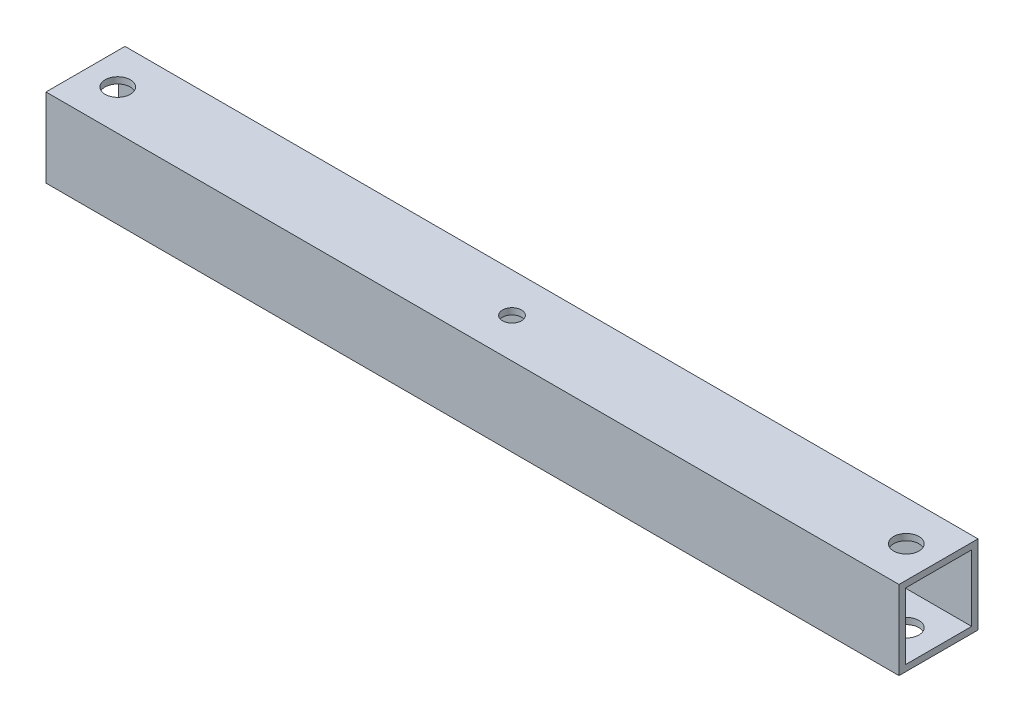
from build123d import *

# Parameters (mm, degrees)
SKETCH1_W           = 25
SKETCH1_H           = 25
SKETCH1_W_2         = 21
SKETCH1_H_2         = 21
BOSS_EXTRUDE1_DEPTH = 270
SKETCH2_R           = 3
CUT_EXTRUDE1_DEPTH  = 273.304976084
SKETCH3_R           = 4
CUT_EXTRUDE2_DEPTH  = 273.304976084


with BuildPart() as part:
    # Sketch1 → Boss-Extrude1 (new body)
    with BuildSketch(Plane(origin=(0, 0, 0), x_dir=(0, 0, -1), z_dir=(1, 0, 0))):
        with Locations((12.5, 12.5)):
            Rectangle(SKETCH1_W, SKETCH1_H)
        with Locations((12.5, 12.5)):
            Rectangle(SKETCH1_W_2, SKETCH1_H_2, mode=Mode.SUBTRACT)
    extrude(amount=BOSS_EXTRUDE1_DEPTH)

    # Sketch2 → Cut-Extrude1 (cut, through all)
    with BuildSketch(Plane(origin=(0, 25, 0), x_dir=(1, 0, 0), z_dir=(0, 1, 0))):
        with Locations(Location((135, 12.5, 0), (0, 0, 270))):
            Circle(SKETCH2_R)
    extrude(amount=-CUT_EXTRUDE1_DEPTH, mode=Mode.SUBTRACT)

    # Sketch3 → Cut-Extrude2 (cut, through all)
    with BuildSketch(Plane(origin=(0, 25, 0), x_dir=(1, 0, 0), z_dir=(0, 1, 0))):
        with Locations(Location((10, 12.7, 0), (0, 0, 270))):
            Circle(SKETCH3_R)
        with Locations(Location((260, 12.3, 0), (0, 0, 270))):
            Circle(SKETCH3_R)
    extrude(amount=-CUT_EXTRUDE2_DEPTH, mode=Mode.SUBTRACT)


solid = part.part
